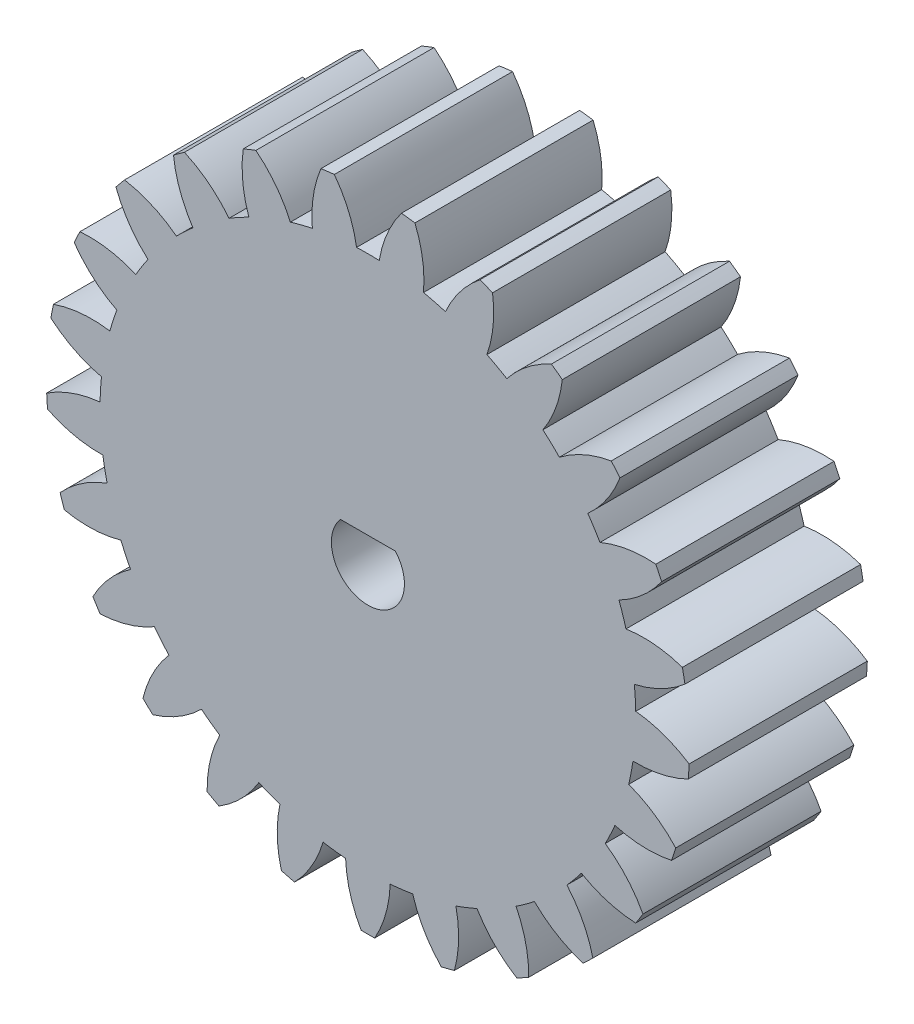
from build123d import *

# Parameters (mm, degrees)
BOSS_EXTRUDE1_DEPTH = 10


with BuildPart() as part:
    # Sketch1 → Boss-Extrude1 (new body)
    with BuildSketch(Plane.XY):
        with BuildLine():
            ThreePointArc((6.994301009, 16.632383564), (6.642138435, 16.776126687), (6.287024027, 16.912414331))
            ThreePointArc((6.287024027, 16.912414331), (5.167401268, 15.768670982), (4.351852136, 14.391505929))
            ThreePointArc((4.351852136, 14.391505929), (3.739075899, 14.562739143), (3.11960376, 14.707893537))
            ThreePointArc((3.11960376, 14.707893537), (3.068386931, 16.307606264), (2.63825659, 17.849258578))
            ThreePointArc((2.63825659, 17.849258578), (2.261410389, 17.900906476), (1.883559194, 17.944599031))
            ThreePointArc((1.883559194, 17.944599031), (1.083548848, 16.558349625), (0.636108713, 15.021631923))
            ThreePointArc((0.636108713, 15.021631923), (0, 15.035094277), (-0.636108713, 15.021631923))
            ThreePointArc((-0.636108713, 15.021631923), (-1.083548848, 16.558349625), (-1.883559194, 17.944599031))
            ThreePointArc((-1.883559194, 17.944599031), (-2.261410389, 17.900906476), (-2.63825659, 17.849258578))
            ThreePointArc((-2.63825659, 17.849258578), (-3.068386931, 16.307606264), (-3.11960376, 14.707893537))
            ThreePointArc((-3.11960376, 14.707893537), (-3.739075899, 14.562739143), (-4.351852136, 14.391505929))
            ThreePointArc((-4.351852136, 14.391505929), (-5.167401268, 15.768670982), (-6.287024027, 16.912414331))
            ThreePointArc((-6.287024027, 16.912414331), (-6.642138435, 16.776126687), (-6.994301009, 16.632383564))
            ThreePointArc((-6.994301009, 16.632383564), (-7.027524675, 15.032196025), (-6.679300055, 13.470004109))
            ThreePointArc((-6.679300055, 13.470004109), (-7.243211909, 13.17535355), (-7.794152684, 12.85710869))
            ThreePointArc((-7.794152684, 12.85710869), (-8.926566862, 13.988188748), (-10.295452017, 14.817560439))
            ThreePointArc((-10.295452017, 14.817560439), (-10.605516495, 14.597241161), (-10.910867773, 14.37043472))
            ThreePointArc((-10.910867773, 14.37043472), (-10.545097198, 12.812257626), (-9.819311364, 11.385744783))
            ThreePointArc((-9.819311364, 11.385744783), (-10.292230275, 10.960112038), (-10.746717955, 10.514852026))
            ThreePointArc((-10.746717955, 10.514852026), (-12.124843431, 11.32877717), (-13.656978894, 11.79166473))
            ThreePointArc((-13.656978894, 11.79166473), (-13.902510949, 11.501157287), (-14.141864588, 11.205538613))
            ThreePointArc((-14.141864588, 11.205538613), (-13.400082482, 9.787277961), (-12.342339226, 8.586077239))
            ThreePointArc((-12.342339226, 8.586077239), (-12.694549961, 8.056206379), (-13.024027412, 7.511908539))
            ThreePointArc((-13.024027412, 7.511908539), (-14.561271495, 7.957536859), (-16.16038756, 8.024855359))
            ThreePointArc((-16.16038756, 8.024855359), (-16.32595951, 7.682413402), (-16.48427604, 7.336557303))
            ThreePointArc((-16.48427604, 7.336557303), (-15.413091302, 6.147327625), (-14.089852523, 5.246914884))
            ThreePointArc((-14.089852523, 5.246914884), (-14.299224386, 4.646099644), (-14.482989328, 4.036964211))
            ThreePointArc((-14.482989328, 4.036964211), (-16.082761318, 4.08629524), (-17.648379642, 3.753814812))
            ThreePointArc((-17.648379642, 3.753814812), (-17.723587993, 3.38095523), (-17.790919803, 3.006593116))
            ThreePointArc((-17.790919803, 3.006593116), (-16.457638909, 2.121118087), (-14.952048567, 1.57806957))
            ThreePointArc((-14.952048567, 1.57806957), (-15.005425953, 0.944061381), (-15.03193176, 0.308362575))
            ThreePointArc((-15.03193176, 0.308362575), (-16.593712099, -0.041703336), (-18.027459124, -0.753091724))
            ThreePointArc((-18.027459124, -0.753091724), (-18.00757826, -1.132940794), (-17.979694645, -1.512286374))
            ThreePointArc((-17.979694645, -1.512286374), (-16.468092537, -2.038369101), (-14.87475241, -2.189931658))
            ThreePointArc((-14.87475241, -2.189931658), (-14.768781422, -2.817295731), (-14.636362636, -3.439614616))
            ThreePointArc((-14.636362636, -3.439614616), (-16.062018922, -4.167081539), (-17.27380705, -5.212678738))
            ThreePointArc((-17.27380705, -5.212678738), (-17.160086157, -5.575649981), (-17.038739148, -5.936143349))
            ThreePointArc((-17.038739148, -5.936143349), (-15.443795346, -6.069778062), (-13.862820853, -5.820331426))
            ThreePointArc((-13.862820853, -5.820331426), (-13.604160038, -6.40163179), (-13.321137019, -6.97146817))
            ThreePointArc((-13.321137019, -6.97146817), (-14.521090024, -8.030626683), (-15.43477815, -9.344733977))
            ThreePointArc((-15.43477815, -9.344733977), (-15.23436273, -9.668020574), (-15.027177006, -9.987010606))
            ThreePointArc((-15.027177006, -9.987010606), (-13.449107694, -9.719800545), (-11.979837279, -9.085018366))
            ThreePointArc((-11.979837279, -9.085018366), (-11.584739247, -9.58372978), (-11.168895371, -10.06527874))
            ThreePointArc((-11.168895371, -10.06527874), (-12.067747635, -11.389578018), (-12.625925373, -12.889625211))
            ThreePointArc((-12.625925373, -12.889625211), (-12.351408265, -13.152913878), (-12.071402067, -13.410357257))
            ThreePointArc((-12.071402067, -13.410357257), (-10.609363144, -12.759092212), (-9.344116469, -11.778860189))
            ThreePointArc((-9.344116469, -11.778860189), (-8.837406683, -12.163646782), (-8.314870951, -12.526650829))
            ThreePointArc((-8.314870951, -12.526650829), (-8.85614428, -14.032880278), (-9.023739271, -15.624613889))
            ThreePointArc((-9.023739271, -15.624613889), (-8.692369394, -15.81136123), (-8.35713654, -15.991081842))
            ThreePointArc((-8.35713654, -15.991081842), (-7.102993289, -14.996683191), (-6.121270456, -13.732592906))
            ThreePointArc((-6.121270456, -13.732592906), (-5.534787355, -13.979277122), (-4.938392608, -14.200927377))
            ThreePointArc((-4.938392608, -14.200927377), (-5.088076809, -15.794445061), (-4.854558443, -17.377850613))
            ThreePointArc((-4.854558443, -17.377850613), (-4.487156985, -17.476322606), (-4.117761389, -17.567027943))
            ThreePointArc((-4.117761389, -17.567027943), (-3.150316243, -16.291977412), (-2.513802508, -14.823456307))
            ThreePointArc((-2.513802508, -14.823456307), (-1.884396983, -14.916538068), (-1.251616896, -14.982907431))
            ThreePointArc((-1.251616896, -14.982907431), (-1.000306759, -16.563586773), (-0.380347854, -18.039173072))
            ThreePointArc((-0.380347854, -18.039173072), (0, -18.043182358), (0.380347854, -18.039173072))
            ThreePointArc((0.380347854, -18.039173072), (1.000306759, -16.563586773), (1.251616896, -14.982907431))
            ThreePointArc((1.251616896, -14.982907431), (1.884396983, -14.916538068), (2.513802508, -14.823456307))
            ThreePointArc((2.513802508, -14.823456307), (3.150316243, -16.291977412), (4.117761389, -17.567027943))
            ThreePointArc((4.117761389, -17.567027943), (4.487156985, -17.476322606), (4.854558443, -17.377850613))
            ThreePointArc((4.854558443, -17.377850613), (5.088076809, -15.794445061), (4.938392608, -14.200927377))
            ThreePointArc((4.938392608, -14.200927377), (5.534787355, -13.979277122), (6.121270456, -13.732592906))
            ThreePointArc((6.121270456, -13.732592906), (7.102993289, -14.996683191), (8.35713654, -15.991081842))
            ThreePointArc((8.35713654, -15.991081842), (8.692369394, -15.81136123), (9.023739271, -15.624613889))
            ThreePointArc((9.023739271, -15.624613889), (8.85614428, -14.032880278), (8.314870951, -12.526650829))
            ThreePointArc((8.314870951, -12.526650829), (8.837406683, -12.163646782), (9.344116469, -11.778860189))
            ThreePointArc((9.344116469, -11.778860189), (10.609363144, -12.759092212), (12.071402067, -13.410357257))
            ThreePointArc((12.071402067, -13.410357257), (12.351408265, -13.152913878), (12.625925373, -12.889625211))
            ThreePointArc((12.625925373, -12.889625211), (12.067747635, -11.389578018), (11.168895371, -10.06527874))
            ThreePointArc((11.168895371, -10.06527874), (11.584739247, -9.58372978), (11.979837279, -9.085018366))
            ThreePointArc((11.979837279, -9.085018366), (13.449107694, -9.719800545), (15.027177006, -9.987010606))
            ThreePointArc((15.027177006, -9.987010606), (15.23436273, -9.668020574), (15.43477815, -9.344733977))
            ThreePointArc((15.43477815, -9.344733977), (14.521090024, -8.030626683), (13.321137019, -6.97146817))
            ThreePointArc((13.321137019, -6.97146817), (13.604160038, -6.40163179), (13.862820853, -5.820331426))
            ThreePointArc((13.862820853, -5.820331426), (15.443795346, -6.069778062), (17.038739148, -5.936143349))
            ThreePointArc((17.038739148, -5.936143349), (17.160086157, -5.575649981), (17.27380705, -5.212678738))
            ThreePointArc((17.27380705, -5.212678738), (16.062018922, -4.167081539), (14.636362636, -3.439614616))
            ThreePointArc((14.636362636, -3.439614616), (14.768781422, -2.817295731), (14.87475241, -2.189931658))
            ThreePointArc((14.87475241, -2.189931658), (16.468092537, -2.038369101), (17.979694645, -1.512286374))
            ThreePointArc((17.979694645, -1.512286374), (18.00757826, -1.132940794), (18.027459124, -0.753091724))
            ThreePointArc((18.027459124, -0.753091724), (16.593712099, -0.041703336), (15.03193176, 0.308362575))
            ThreePointArc((15.03193176, 0.308362575), (15.005425953, 0.944061381), (14.952048567, 1.57806957))
            ThreePointArc((14.952048567, 1.57806957), (16.457638909, 2.121118087), (17.790919803, 3.006593116))
            ThreePointArc((17.790919803, 3.006593116), (17.723587993, 3.38095523), (17.648379642, 3.753814812))
            ThreePointArc((17.648379642, 3.753814812), (16.082761318, 4.08629524), (14.482989328, 4.036964211))
            ThreePointArc((14.482989328, 4.036964211), (14.299224386, 4.646099644), (14.089852523, 5.246914884))
            ThreePointArc((14.089852523, 5.246914884), (15.413091302, 6.147327625), (16.48427604, 7.336557303))
            ThreePointArc((16.48427604, 7.336557303), (16.32595951, 7.682413402), (16.16038756, 8.024855359))
            ThreePointArc((16.16038756, 8.024855359), (14.561271495, 7.957536859), (13.024027412, 7.511908539))
            ThreePointArc((13.024027412, 7.511908539), (12.694549961, 8.056206379), (12.342339226, 8.586077239))
            ThreePointArc((12.342339226, 8.586077239), (13.400082482, 9.787277961), (14.141864588, 11.205538613))
            ThreePointArc((14.141864588, 11.205538613), (13.902510949, 11.501157287), (13.656978894, 11.79166473))
            ThreePointArc((13.656978894, 11.79166473), (12.124843431, 11.32877717), (10.746717955, 10.514852026))
            ThreePointArc((10.746717955, 10.514852026), (10.292230275, 10.960112038), (9.819311364, 11.385744783))
            ThreePointArc((9.819311364, 11.385744783), (10.545097198, 12.812257626), (10.910867773, 14.37043472))
            ThreePointArc((10.910867773, 14.37043472), (10.605516495, 14.597241161), (10.295452017, 14.817560439))
            ThreePointArc((10.295452017, 14.817560439), (8.926566862, 13.988188748), (7.794152684, 12.85710869))
            ThreePointArc((7.794152684, 12.85710869), (7.243211909, 13.17535355), (6.679300055, 13.470004109))
            ThreePointArc((6.679300055, 13.470004109), (7.027524675, 15.032196025), (6.994301009, 16.632383564))
        make_face()
        with BuildLine():
            Line((-1.542724862, 1.35), (1.542724862, 1.35))
            ThreePointArc((1.542724862, 1.35), (0, -2.05), (-1.542724862, 1.35))
        make_face(mode=Mode.SUBTRACT)
    extrude(amount=BOSS_EXTRUDE1_DEPTH)


solid = part.part
